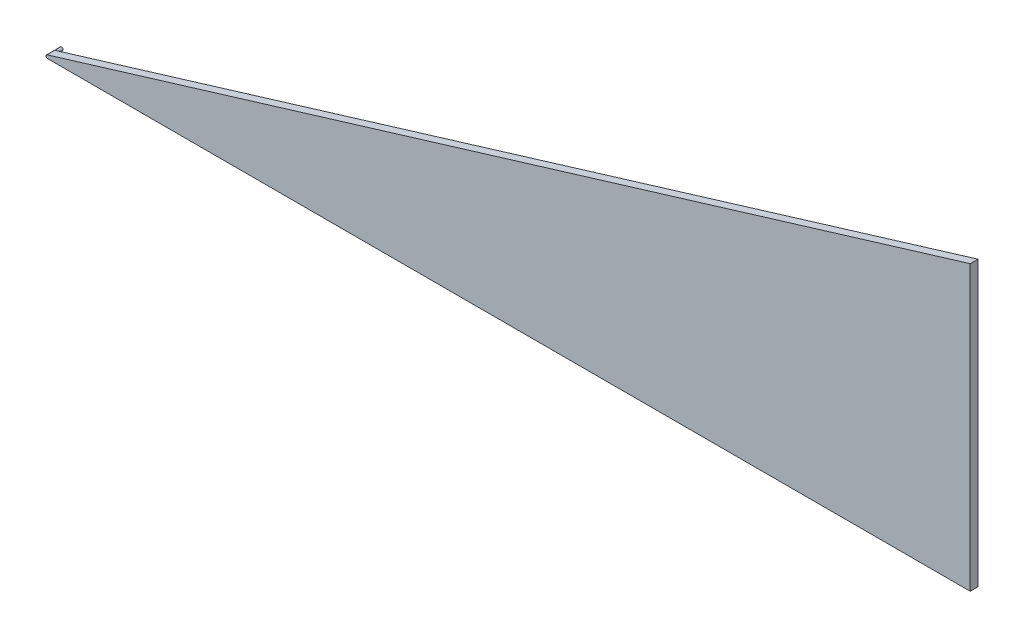
from build123d import *
from build123d.topology import SkipClean

# Parameters (mm, degrees)
SKETCH_1_R      = 20
EXTRUDE_1_DEPTH = 80
EXTRUDE_2_DEPTH = 100


with BuildPart() as part:
    # 草图1 → 凸台-拉伸1 (new body)
    with BuildSketch(Plane.XY):
        Circle(SKETCH_1_R)
    extrude(amount=EXTRUDE_1_DEPTH)

    # 草图2 → 凸台-拉伸2 (add)
    with SkipClean():  # the faces are left unmerged after this step: merging them gives an invalid solid
        with BuildSketch(Plane.XY.offset(80)):
            with BuildLine():
                Line((-5.818295023, 19.134979567), (11858.298972938, 3626.608622721))
                Line((11858.298972938, 3626.608622721), (11858.298972938, -20))
                Line((11858.298972938, -20), (0, -20))
                ThreePointArc((0, -20), (-19.78256292, -2.941122971), (-5.818295023, 19.134979567))
            make_face()
        extrude(amount=EXTRUDE_2_DEPTH)


solid = part.part
